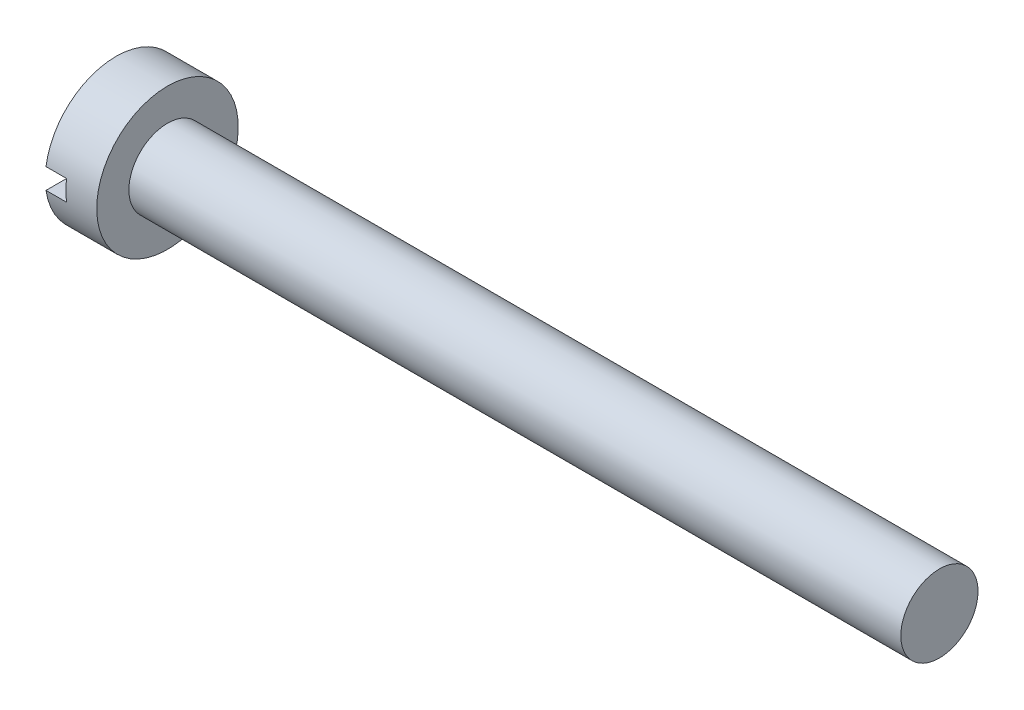
from build123d import *

# Parameters (mm, degrees)
SKETCH2_W          = 5.5
SKETCH2_H          = 0.8
CUT_EXTRUDE1_DEPTH = 0.8


with BuildPart() as part:
    # Sketch1 → Revolve1 (revolve)
    with BuildSketch(Plane.XY):
        Polygon((0, 0), (0, 2.75), (2, 2.75), (2, 1.5), (32, 1.5), (32, 0), align=None)
    revolve(axis=Axis((32, 0, 0), (-1, 0, 0)))

    # Sketch2 → Cut-Extrude1 (cut)
    with BuildSketch(Plane.ZY):
        Rectangle(SKETCH2_W, SKETCH2_H)
    extrude(amount=-CUT_EXTRUDE1_DEPTH, mode=Mode.SUBTRACT)


solid = part.part
